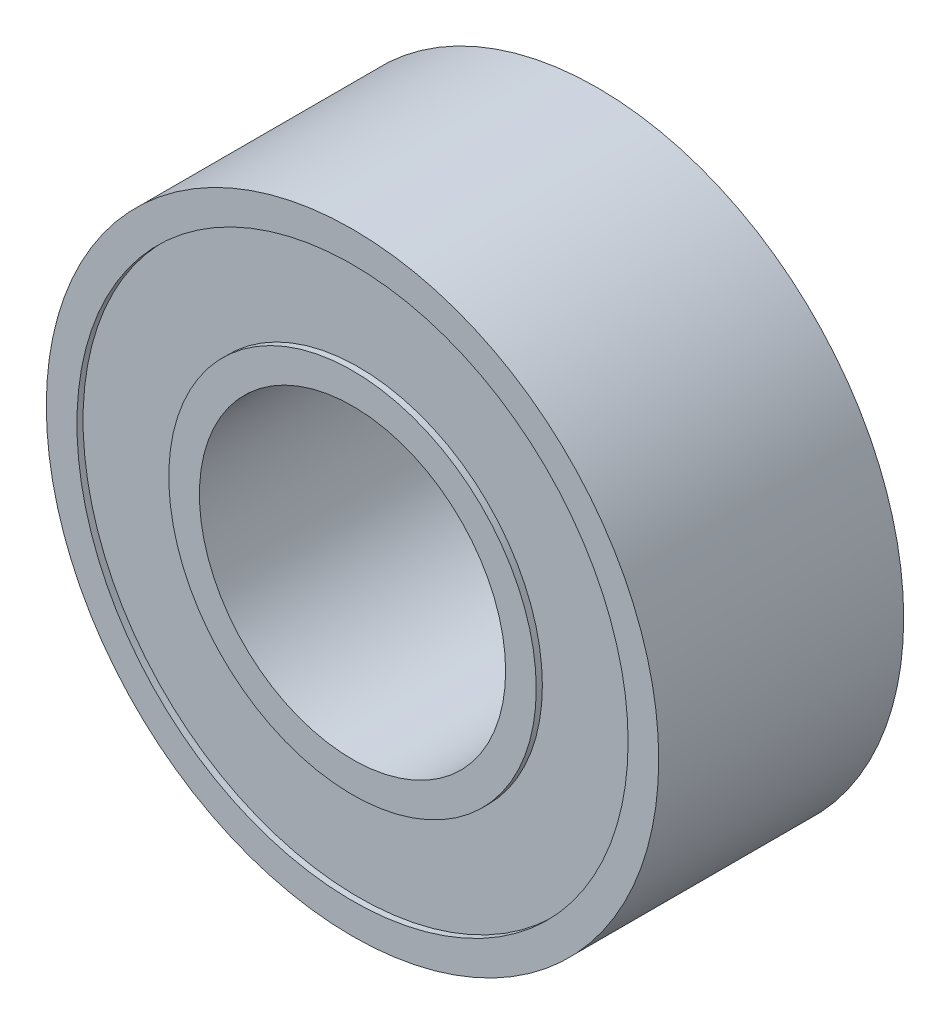
from build123d import *

# Parameters (mm, degrees)
SKETCH1_R           = 5
SKETCH1_R_2         = 2.5
BOSS_EXTRUDE1_DEPTH = 2
SKETCH2_R           = 4.5
SKETCH2_R_2         = 3
CUT_EXTRUDE1_DEPTH  = 0.1


with BuildPart() as part:
    # Sketch1 → Boss-Extrude1 (new, symmetric)
    with BuildSketch(Plane.XY):
        Circle(SKETCH1_R)
        Circle(SKETCH1_R_2, mode=Mode.SUBTRACT)
    extrude(amount=BOSS_EXTRUDE1_DEPTH, both=True)

    # Sketch2 → Cut-Extrude1 (cut)
    with BuildSketch(Plane.XY.offset(2)):
        Circle(SKETCH2_R)
        Circle(SKETCH2_R_2, mode=Mode.SUBTRACT)
    cut_extrude1 = extrude(amount=-CUT_EXTRUDE1_DEPTH, mode=Mode.SUBTRACT)

    # Mirror1: Cut-Extrude1 across plane
    add(cut_extrude1.mirror(Plane.XY), mode=Mode.SUBTRACT)


solid = part.part
